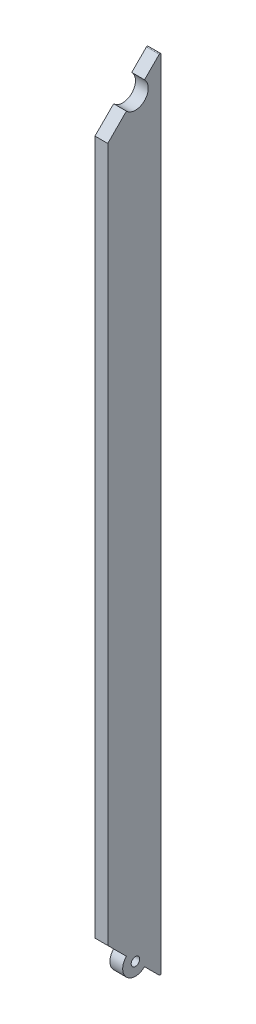
from build123d import *

# Parameters (mm, degrees)
BOSS_EXTRUDE1_DEPTH = 6
FILLET1_R           = 0.5
SKETCH4_R           = 6
BOSS_EXTRUDE2_DEPTH = 6
SKETCH3_R           = 6
SKETCH3_R_2         = 2
CUT_EXTRUDE1_DEPTH  = 377.172507901


with BuildPart() as part:
    # Sketch2 → Boss-Extrude1 (new body)
    with BuildSketch(Plane(origin=(0, 0, 0), x_dir=(0, 0, -1), z_dir=(1, 0, 0))):
        Polygon((0, 376), (0, 0), (-25, 25), (-25, 351), align=None)
    extrude(amount=BOSS_EXTRUDE1_DEPTH)

    # Fillet1
    fillet1_edges = [part.edges().sort_by_distance(p)[0] for p in [
        (3, 376, 0),
        (3, 0, 0),
    ]]
    fillet(fillet1_edges, radius=FILLET1_R)

    # Sketch4 → Boss-Extrude2 (add)
    with BuildSketch(Plane.ZY):
        with Locations((12, 12)):
            Circle(SKETCH4_R)
    extrude(amount=-BOSS_EXTRUDE2_DEPTH)

    # Sketch3 → Cut-Extrude1 (cut, through all)
    with BuildSketch(Plane(origin=(6, 0, 0), x_dir=(0, 0, -1), z_dir=(1, 0, 0))):
        with Locations((-12, 364)):
            Circle(SKETCH3_R)
        with Locations((-12, 12)):
            Circle(SKETCH3_R_2)
    extrude(amount=-CUT_EXTRUDE1_DEPTH, mode=Mode.SUBTRACT)


solid = part.part
